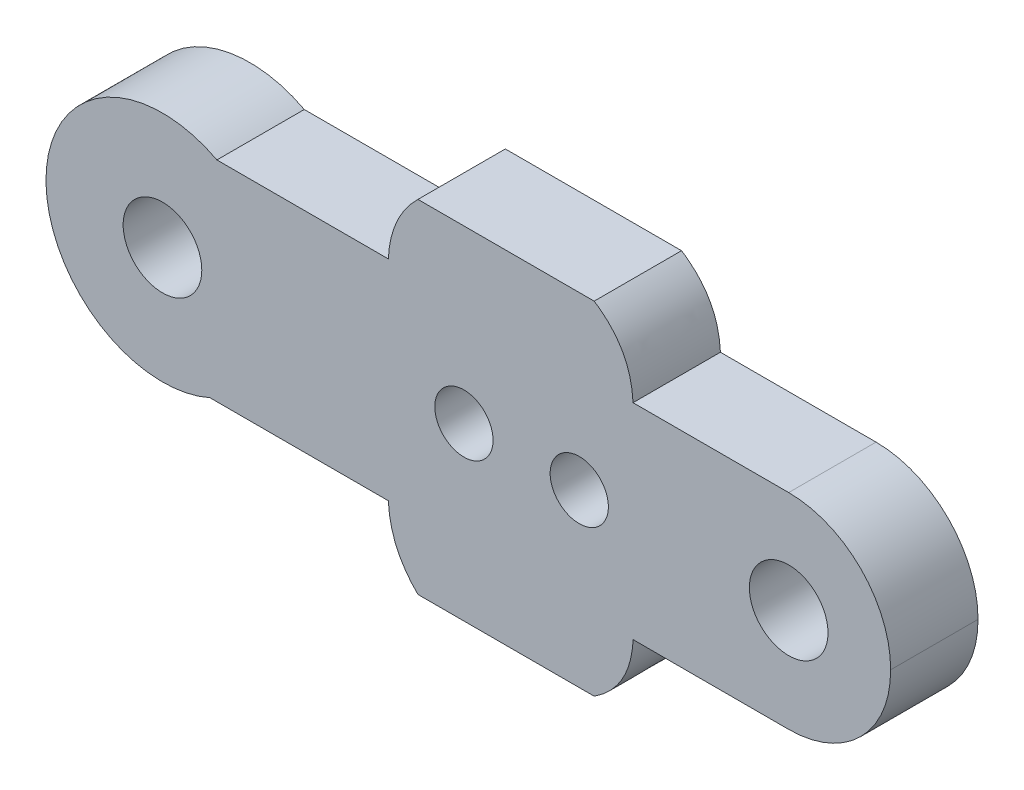
from build123d import *

# Parameters (mm, degrees)
SKETCH_3_R      = 1.35
SKETCH_3_R_2    = 1
EXTRUDE_2_DEPTH = 3


with BuildPart() as part:
    # 草图3 → 凸台-拉伸2 (new body)
    with BuildSketch(Plane.XY):
        with BuildLine():
            Line((21.499968123, 3.52141019), (16.156278552, 3.52141019))
            add(Edge.make_bspline(
                [(16.156278552, 3.52141019), (16.088160339, 5.051537173), (14.821900334, 5.873909505)],
                knots=[0, 0, 0, 1, 1, 1], degree=2))
            Line((14.821900334, 5.873909505), (8.771282217, 5.873909505))
            add(Edge.make_bspline(
                [(7.754778373, 3.595279655), (7.816403966, 4.944689103), (8.771282217, 5.873909505)],
                knots=[0, 0, 0, 1, 1, 1], degree=2))
            Line((7.754778373, 3.595279655), (1.868346732, 3.595279655))
            ThreePointArc((1.868346732, 3.595279655), (-3.997767344, 0.192060873), (1.627998751, -3.595279655))
            Line((1.627998751, -3.595279655), (7.754778373, -3.595279655))
            add(Edge.make_bspline(
                [(7.754778373, -3.595279655), (7.816403966, -4.944689103), (8.771282217, -5.873909505)],
                knots=[0, 0, 0, 1, 1, 1], degree=2))
            Line((8.771282217, -5.873909505), (14.821900334, -5.873909505))
            add(Edge.make_bspline(
                [(16.156278552, -3.52141019), (16.088160339, -5.051537173), (14.821900334, -5.873909505)],
                knots=[0, 0, 0, 1, 1, 1], degree=2))
            Line((16.156278552, -3.52141019), (21.499968123, -3.52141019))
            ThreePointArc((21.499968123, -3.52141019), (23.982399961, -2.488702667), (24.999902637, 0))
            ThreePointArc((24.999902637, 0), (23.982399961, 2.488702667), (21.499968123, 3.52141019))
        make_face()
        with Locations((0, 0.058433534)):
            Circle(SKETCH_3_R, mode=Mode.SUBTRACT)
        with Locations((10.35, 0)):
            Circle(SKETCH_3_R_2, mode=Mode.SUBTRACT)
        with Locations((14.31, 0)):
            Circle(SKETCH_3_R_2, mode=Mode.SUBTRACT)
        with Locations((21.499968123, 0.02141019)):
            Circle(SKETCH_3_R, mode=Mode.SUBTRACT)
    extrude(amount=EXTRUDE_2_DEPTH)


solid = part.part
